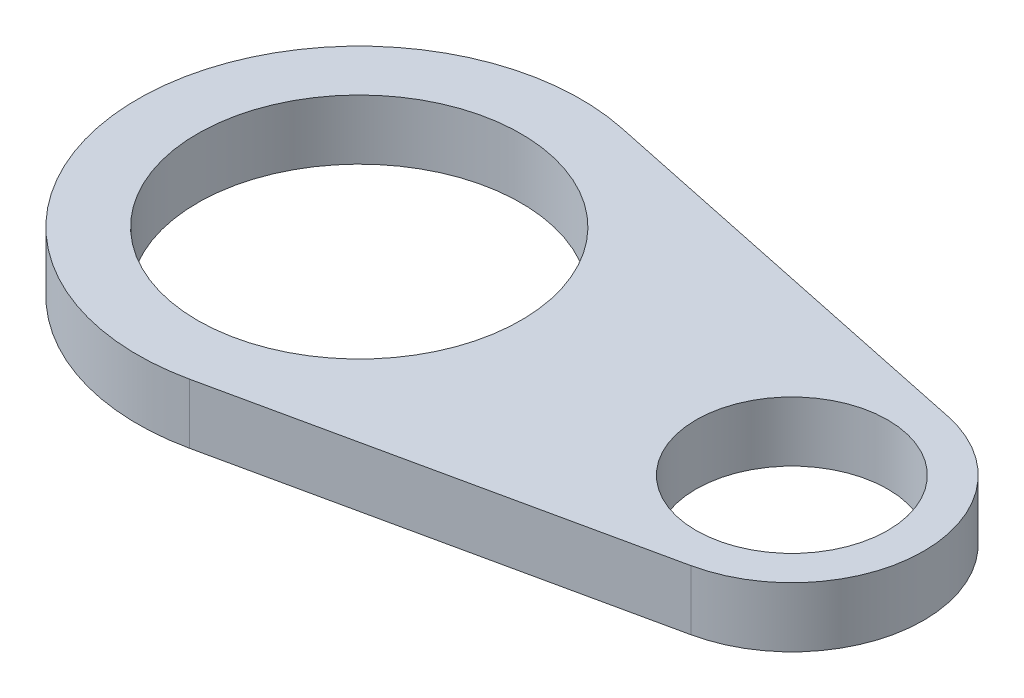
from build123d import *

# Parameters (mm, degrees)
SKETCH2_R           = 18.5
SKETCH2_R_2         = 13.5
BOSS_EXTRUDE2_DEPTH = 5
BOSS_EXTRUDE3_DEPTH = 5
SKETCH4_R           = 11
BOSS_EXTRUDE4_DEPTH = 5
SKETCH5_R           = 8
CUT_EXTRUDE1_DEPTH  = 5
BOSS_EXTRUDE5_DEPTH = 5
BOSS_EXTRUDE6_DEPTH = 5


with BuildPart() as part:
    # Sketch2 → Boss-Extrude2 (new body)
    with BuildSketch(Plane(origin=(0, 0, 0), x_dir=(1, 0, 0), z_dir=(0, 1, 0))):
        with Locations(Location((0, 0, 0), (0, 0, 270))):
            Circle(SKETCH2_R)
        with Locations(Location((0, 0, 0), (0, 0, 270))):
            Circle(SKETCH2_R_2, mode=Mode.SUBTRACT)
    extrude(amount=BOSS_EXTRUDE2_DEPTH)

    # Sketch3 → Boss-Extrude3 (add)
    with BuildSketch(Plane(origin=(0, 5, 0), x_dir=(1, 0, 0), z_dir=(0, 1, 0))):
        Polygon((25.460427034, 3.126984488), (25.460427034, -2.892028048), (18.27255247, -2.892028048), (18.27255247, 2.892028048), align=None)
    extrude(amount=-BOSS_EXTRUDE3_DEPTH)

    # Sketch4 → Boss-Extrude4 (add)
    with BuildSketch(Plane(origin=(0, 5, 0), x_dir=(1, 0, 0), z_dir=(0, 1, 0))):
        with Locations((36, 0.11747822)):
            Circle(SKETCH4_R)
    extrude(amount=-BOSS_EXTRUDE4_DEPTH)

    # Sketch5 → Cut-Extrude1 (cut)
    with BuildSketch(Plane(origin=(0, 5, 0), x_dir=(1, 0, 0), z_dir=(0, 1, 0))):
        with Locations(Location((36, 0.11747822, 0), (0, 0, 270))):
            Circle(SKETCH5_R)
    extrude(amount=-CUT_EXTRUDE1_DEPTH, mode=Mode.SUBTRACT)

    # Sketch6 → Boss-Extrude5 (add)
    with BuildSketch(Plane(origin=(0, 5, 0), x_dir=(1, 0, 0), z_dir=(0, 1, 0))):
        Polygon((38.256533955, 10.883538526), (3.795079834, 18.106555969), (18.27255247, 2.892028048), (25.419311952, 3.125640523), align=None)
    extrude(amount=-BOSS_EXTRUDE5_DEPTH)

    # Sketch7 → Boss-Extrude6 (add)
    with BuildSketch(Plane(origin=(0, 5, 0), x_dir=(1, 0, 0), z_dir=(0, 1, 0))):
        Polygon((38.32675057, -10.633625527), (3.913171414, -18.081401757), (18.27255247, -2.892028048), (25.419694143, -2.892028048), align=None)
    extrude(amount=-BOSS_EXTRUDE6_DEPTH)


solid = part.part
